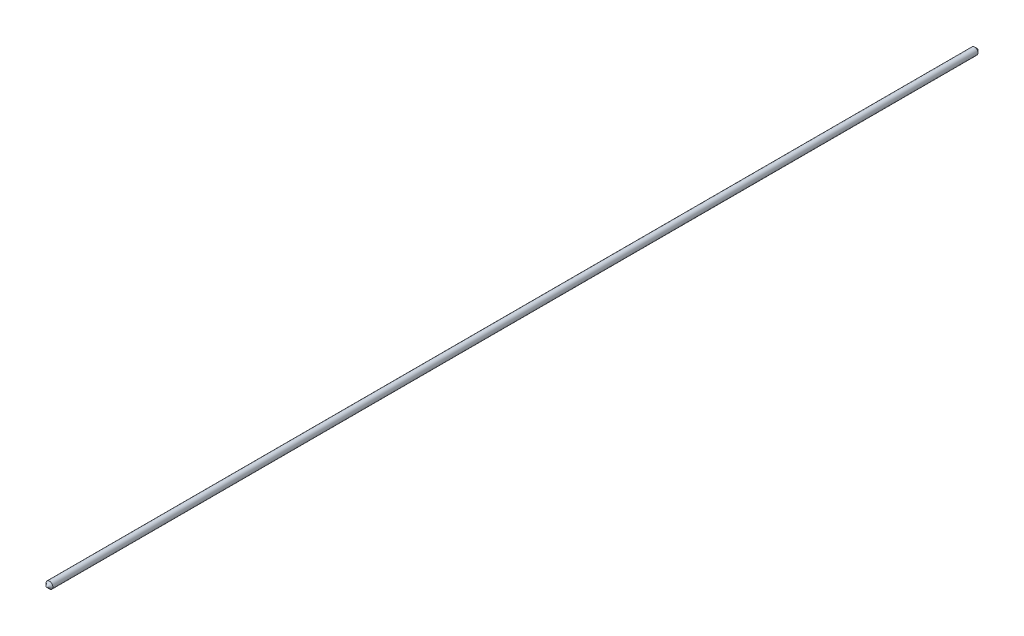
from build123d import *


with BuildPart() as part:
    # Sketch1 → Revolve1 (revolve)
    with BuildSketch(Plane(origin=(0, 0, 0), x_dir=(0, 0, -1), z_dir=(1, 0, 0)), mode=Mode.PRIVATE) as revolve1_sk:
        Polygon((24.276564036, 0), (34.17584387, 10), (2743.640292116, 10), (2753.745564036, 0), (2057.660148801, 0), align=None)
    revolve(revolve1_sk.sketch.rotate(Axis((0, 0, -24.276564036), (0, 0, -1)), 180), axis=Axis((0, 0, -24.276564036), (0, 0, -1)))


solid = part.part
